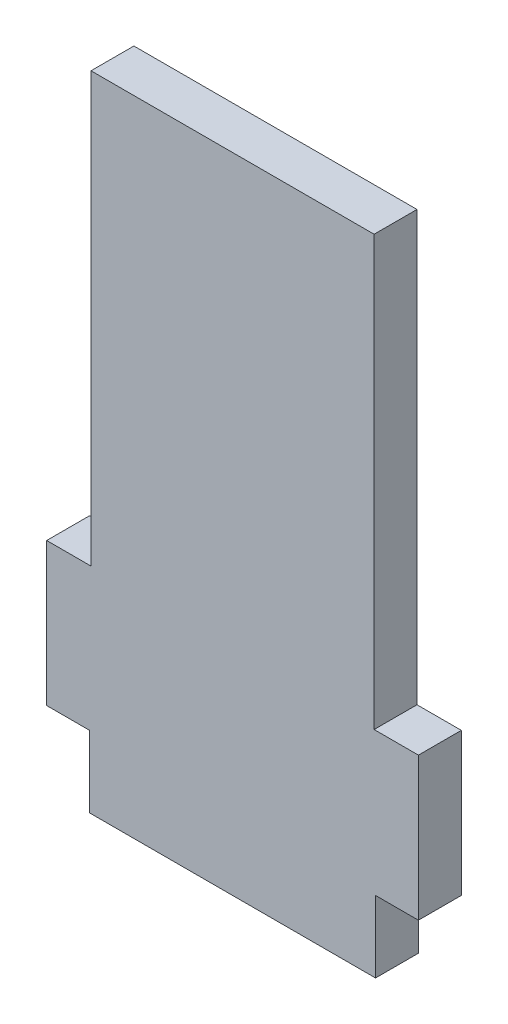
from build123d import *

# Parameters (mm, degrees)
SKETCH2_W           = 26
SKETCH2_H           = 3
BOSS_EXTRUDE1_DEPTH = 10
SKETCH4_W           = 19.8
SKETCH4_H           = 3
BOSS_EXTRUDE2_DEPTH = 30
SKETCH5_W           = 20
SKETCH5_H           = 3
BOSS_EXTRUDE3_DEPTH = 5


with BuildPart() as part:
    # Sketch2 → Boss-Extrude1 (new body)
    with BuildSketch(Plane(origin=(0, 0, 0), x_dir=(1, 0, 0), z_dir=(0, 1, 0))):
        Rectangle(SKETCH2_W, SKETCH2_H)
    extrude(amount=BOSS_EXTRUDE1_DEPTH)

    # Sketch4 → Boss-Extrude2 (add)
    with BuildSketch(Plane(origin=(0, 10, 0), x_dir=(1, 0, 0), z_dir=(0, 1, 0))):
        Rectangle(SKETCH4_W, SKETCH4_H)
    extrude(amount=BOSS_EXTRUDE2_DEPTH)

    # Sketch5 → Boss-Extrude3 (add)
    with BuildSketch(Plane.XZ):
        Rectangle(SKETCH5_W, SKETCH5_H)
    extrude(amount=BOSS_EXTRUDE3_DEPTH)


solid = part.part
